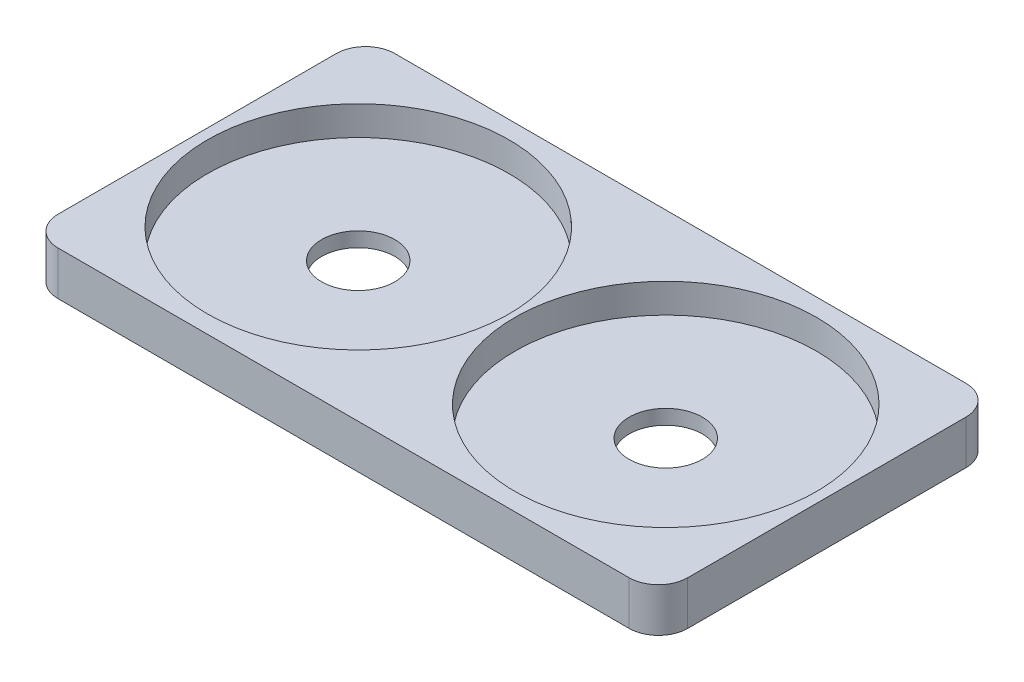
from build123d import *

# Parameters (mm, degrees)
CROQUIS1_W              = 43
CROQUIS1_H              = 23
SALIENTE_EXTRUIR1_DEPTH = 3
REDONDEO1_R             = 2
CROQUIS2_R              = 10.3
CORTAR_EXTRUIR1_DEPTH   = 2
CROQUIS3_R              = 2.5
CORTAR_EXTRUIR2_DEPTH   = 1


with BuildPart() as part:
    # Croquis1 → Saliente-Extruir1 (new body)
    with BuildSketch(Plane(origin=(0, 0, 0), x_dir=(1, 0, 0), z_dir=(0, 1, 0))):
        Rectangle(CROQUIS1_W, CROQUIS1_H)
    extrude(amount=SALIENTE_EXTRUIR1_DEPTH)

    # Redondeo1
    redondeo1_edges = [part.edges().sort_by_distance(p)[0] for p in [
        (21.5, 1.5, 11.5),
        (-21.5, 1.5, 11.5),
        (-21.5, 1.5, -11.5),
        (21.5, 1.5, -11.5),
    ]]
    fillet(redondeo1_edges, radius=REDONDEO1_R)

    # Croquis2 → Cortar-Extruir1 (cut)
    with BuildSketch(Plane(origin=(0, 3, 0), x_dir=(1, 0, 0), z_dir=(0, 1, 0))):
        with Locations(Location((-10.5, 0, 0), (0, 0, 270))):
            Circle(CROQUIS2_R)
        with Locations(Location((10.5, 0, 0), (0, 0, 90))):
            Circle(CROQUIS2_R)
    extrude(amount=-CORTAR_EXTRUIR1_DEPTH, mode=Mode.SUBTRACT)

    # Croquis3 → Cortar-Extruir2 (cut)
    with BuildSketch(Plane(origin=(0, 1, 0), x_dir=(1, 0, 0), z_dir=(0, 1, 0))):
        with Locations(Location((-10.5, 0, 0), (0, 0, 270))):
            Circle(CROQUIS3_R)
        with Locations(Location((10.5, 0, 0), (0, 0, 270))):
            Circle(CROQUIS3_R)
    extrude(amount=-CORTAR_EXTRUIR2_DEPTH, mode=Mode.SUBTRACT)


solid = part.part
